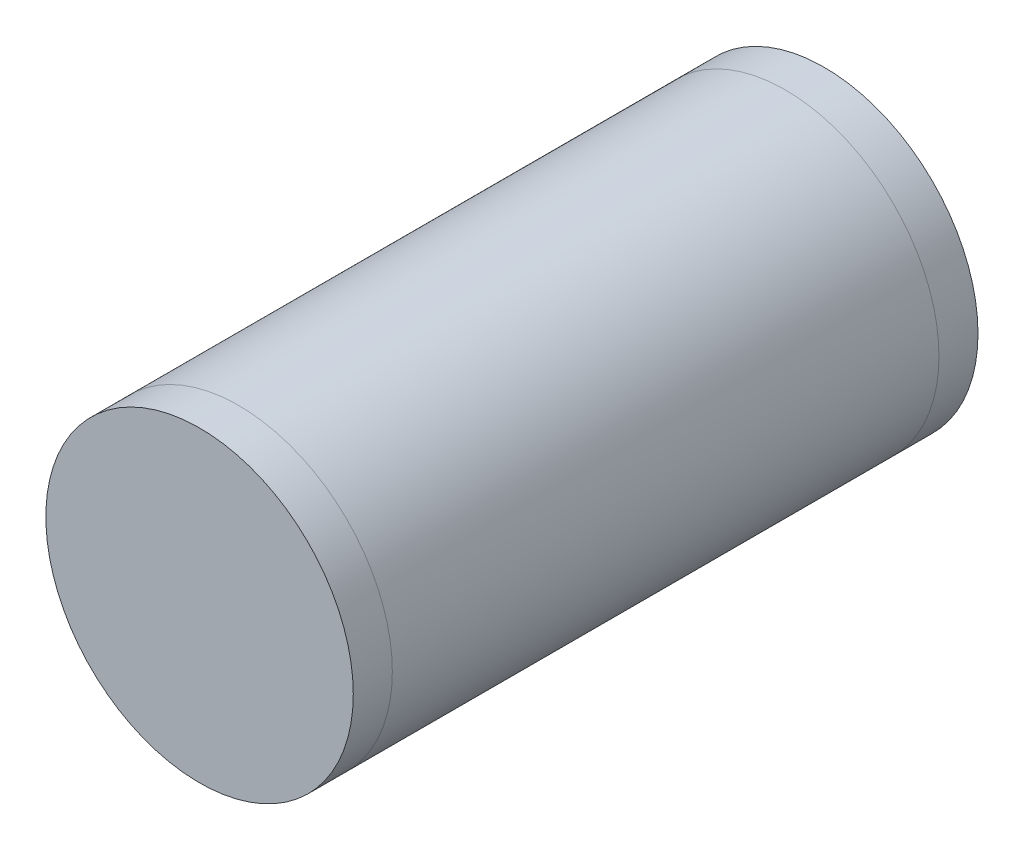
from build123d import *

# Parameters (mm, degrees)
E_HOUSING_BASE_SKETCH_R   = 50
E_HOUSING_BASE_SKETCH_R_2 = 45
E_HOUSING_BASE_DEPTH      = 88.9
SKETCH3_R                 = 50
END_CAP_1_DEPTH           = 12.7


with BuildPart() as part:
    # E-Housing Base Sketch → E-Housing Base (new, symmetric)
    with BuildSketch(Plane.XY):
        Circle(E_HOUSING_BASE_SKETCH_R)
        Circle(E_HOUSING_BASE_SKETCH_R_2, mode=Mode.SUBTRACT)
    extrude(amount=E_HOUSING_BASE_DEPTH, both=True)


with BuildPart() as body_2:
    # Sketch3 → End Cap 1 (new body)
    with BuildSketch(Plane.XY.offset(88.9)):
        Circle(SKETCH3_R)
    extrude(amount=END_CAP_1_DEPTH)


with BuildPart() as body_3:
    # End Cap 2: mirrored copy
    add(body_2.part.mirror(Plane.XY))


solid = Compound([part.part, body_2.part, body_3.part])
